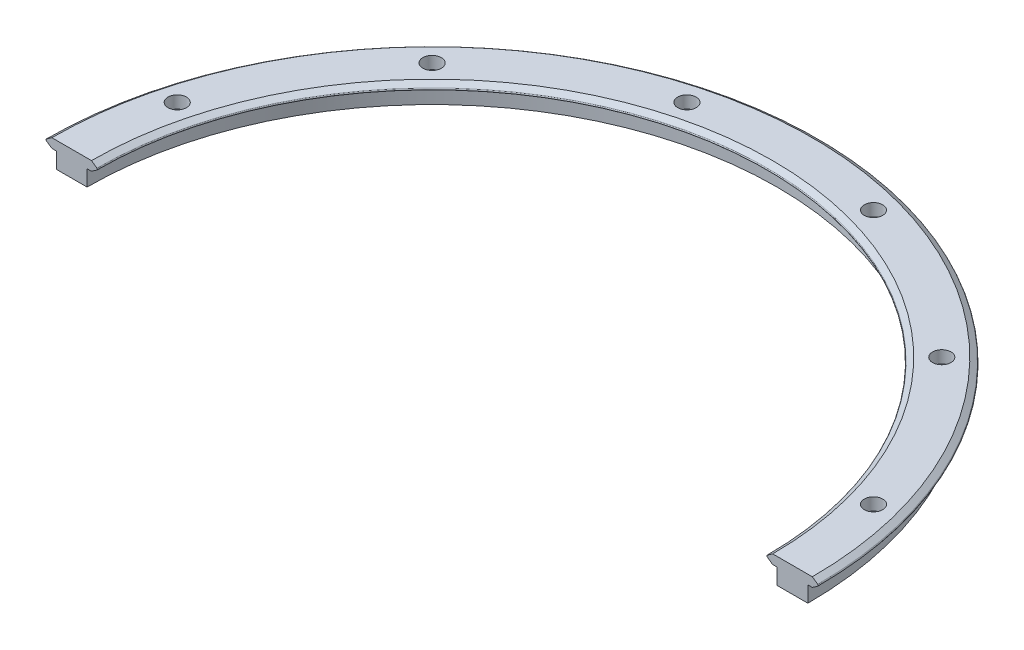
from build123d import *

# Parameters (mm, degrees)
SKETCH_2_R                   = 183
EXTRUDE_1_DEPTH              = 7.75
HOLE_WIZARD_M5_1_D           = 5.5
HOLE_WIZARD_M5_1_CBORE_D     = 9
HOLE_WIZARD_M5_1_CBORE_DEPTH = 6
SKETCH_6_W                   = 499.91157149
SKETCH_6_H                   = 215.35218654
CUT_EXTRUDE_1_DEPTH          = 267.151754372


with BuildPart() as part:
    # 草图1 → 旋转1 (revolve)
    with BuildSketch(Plane.XY, mode=Mode.PRIVATE) as revolve_1_sk:
        with BuildLine():
            Line((185.156666985, 2.25), (0, 2.25))
            Line((0, 2.25), (0, -2.25))
            Line((0, -2.25), (185.156666985, -2.25))
            Line((185.156666985, -2.25), (187.78506482, -0.409576022))
            add(Edge.make_bspline(
                [(187.78506482, 0.409576022), (187.830906121, 0.377477598), (187.871837762, 0.337021948), (187.904470176, 0.291559224), (187.937102589, 0.246096499), (187.962335818, 0.194372782), (187.978080287, 0.140671335), (187.993824756, 0.086969887), (188.000514717, 0.029809558), (187.997596172, -0.026076181), (187.994677627, -0.08196192), (187.982070079, -0.138114466), (187.960817564, -0.189883804), (187.939565048, -0.241653142), (187.909081396, -0.290467133), (187.87189097, -0.332283469), (187.846140091, -0.361237358), (187.816805619, -0.387350876), (187.78506482, -0.409576022)],
                knots=[0, 0, 0, 0, 0.000167886, 0.000167886, 0.000167886, 0.000335771, 0.000335771, 0.000335771, 0.000503657, 0.000503657, 0.000503657, 0.000671543, 0.000671543, 0.000671543, 0.000839428, 0.000839428, 0.000839428, 0.000954806, 0.000954806, 0.000954806, 0.000954806], degree=3))
            Line((187.78506482, 0.409576022), (185.156666985, 2.25))
        make_face()
    revolve(revolve_1_sk.sketch.rotate(Axis((0, 2.25, 0), (0, -1, 0)), 270), axis=Axis((0, 2.25, 0), (0, -1, 0)))

    # 草图2 → 凸台-拉伸1 (add)
    with BuildSketch(Plane.XZ.offset(2.25)):
        with Locations(Location((0, 0, 0), (0, 0, 270))):
            Circle(SKETCH_2_R)
    extrude(amount=EXTRUDE_1_DEPTH)

    # 草图3 → 切除-旋转1 (revolve, cut)
    with BuildSketch(Plane.XY, mode=Mode.PRIVATE) as cut_revolve_1_sk:
        with BuildLine():
            Line((165.843333015, 2.25), (0, 2.25))
            Line((0, 2.25), (0, -10))
            Line((0, -10), (168, -10))
            Line((168, -10), (168, -2.25))
            Line((168, -2.25), (165.843333015, -2.25))
            Line((165.843333015, -2.25), (163.21493518, -0.409576022))
            ThreePointArc((163.21493518, -0.409576022), (163.001723398, 0), (163.21493518, 0.409576022))
            Line((163.21493518, 0.409576022), (165.843333015, 2.25))
        make_face()
    revolve(cut_revolve_1_sk.sketch.rotate(Axis((0, 2.25, 0), (0, -1, 0)), 270), axis=Axis((0, 2.25, 0), (0, -1, 0)), mode=Mode.SUBTRACT)

    # M5 六角头螺栓的柱形沉头孔1 (through all)
    with Locations(Plane(origin=(0, 2.25, 0), x_dir=(1, 0, 0), z_dir=(0, 1, 0))):
        with Locations((-45.422742415, -169.519982514), (-124.097240098, -124.097240098), (-169.519982514, -45.422742415), (45.422742415, -169.519982514), (124.097240098, -124.097240098), (169.519982514, -45.422742415), (-45.422742415, 169.519982514), (-124.097240098, 124.097240098), (-169.519982514, 45.422742415), (45.422742415, 169.519982514), (124.097240098, 124.097240098), (169.519982514, 45.422742415)):
            CounterBoreHole(HOLE_WIZARD_M5_1_D / 2, HOLE_WIZARD_M5_1_CBORE_D / 2, HOLE_WIZARD_M5_1_CBORE_DEPTH)

    # 草图6 → 切除-拉伸1 (cut, through all)
    with BuildSketch(Plane(origin=(0, 2.25, 0), x_dir=(1, 0, 0), z_dir=(0, 1, 0))):
        with Locations((-5.153727541, -107.67609327)):
            Rectangle(SKETCH_6_W, SKETCH_6_H)
    extrude(amount=-CUT_EXTRUDE_1_DEPTH, mode=Mode.SUBTRACT)


solid = part.part
